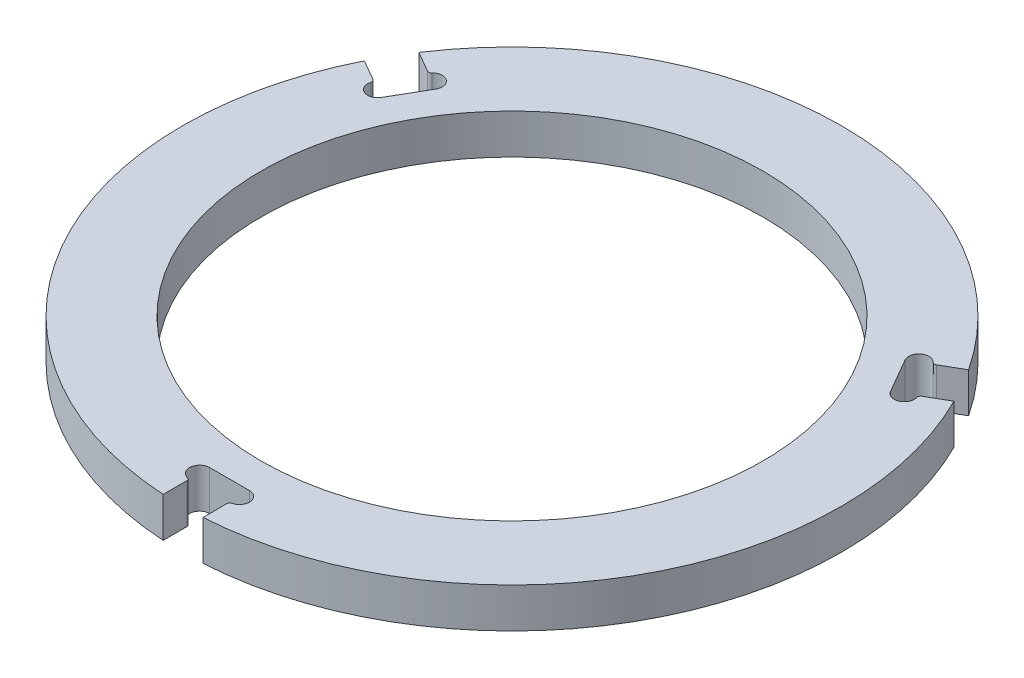
from build123d import *

# Parameters (mm, degrees)
SKETCH1_R                = 105
SKETCH1_R_2              = 80
BOSS_EXTRUDE1_DEPTH      = 12.7
CUT_EXTRUDE1_DEPTH       = 150.034526201
FILLET1_R                = 1
CIRPATTERN1_COUNT        = 3
FILLET1_OF_CIRPATTERN1_R = 1


with BuildPart() as part:
    # Sketch1 → Boss-Extrude1 (new body)
    with BuildSketch(Plane(origin=(0, 0, 0), x_dir=(1, 0, 0), z_dir=(0, 1, 0))):
        with Locations(Location((0, 0, 0), (0, 0, 270))):
            Circle(SKETCH1_R)
        with Locations(Location((0, 0, 0), (0, 0, 270))):
            Circle(SKETCH1_R_2, mode=Mode.SUBTRACT)
    extrude(amount=BOSS_EXTRUDE1_DEPTH)

    # Sketch2 → Cut-Extrude1 (cut, through all)
    with BuildSketch(Plane(origin=(0, 12.7, 0), x_dir=(1, 0, 0), z_dir=(0, 1, 0))):
        with BuildLine():
            Line((6.35, -105), (-6.35, -105))
            Line((-6.35, -105), (-6.35, -96.4))
            ThreePointArc((-6.35, -96.4), (-9.55, -93.2), (-6.35, -90))
            Line((-6.35, -90), (6.35, -90))
            ThreePointArc((6.35, -90), (9.55, -93.2), (6.35, -96.4))
            Line((6.35, -96.4), (6.35, -105))
        make_face()
    cut_extrude1 = extrude(amount=-CUT_EXTRUDE1_DEPTH, mode=Mode.SUBTRACT)

    # Fillet1
    fillet1_edges = [part.edges().sort_by_distance(p)[0] for p in [
        (6.35, 6.35, 96.4),
        (-6.35, 6.35, 96.4),
    ]]
    fillet(fillet1_edges, radius=FILLET1_R)

    # CirPattern1: Cut-Extrude1 ×3 about axis
    cirpattern1_axis = Axis((0, 0, 0), (0, 1, 0))
    for i in range(1, CIRPATTERN1_COUNT):
        add(cut_extrude1.rotate(cirpattern1_axis, i * 360 / CIRPATTERN1_COUNT), mode=Mode.SUBTRACT)

    # Fillet1 of CirPattern1
    fillet1_of_cirpattern1_edges = [part.edges().sort_by_distance(p)[0] for p in [
        (80.309848925, 6.35, -53.699261314),
        (86.659848925, 6.35, -42.700738686),
        (-86.659848925, 6.35, -42.700738686),
        (-80.309848925, 6.35, -53.699261314),
    ]]
    fillet(fillet1_of_cirpattern1_edges, radius=FILLET1_OF_CIRPATTERN1_R)


solid = part.part
